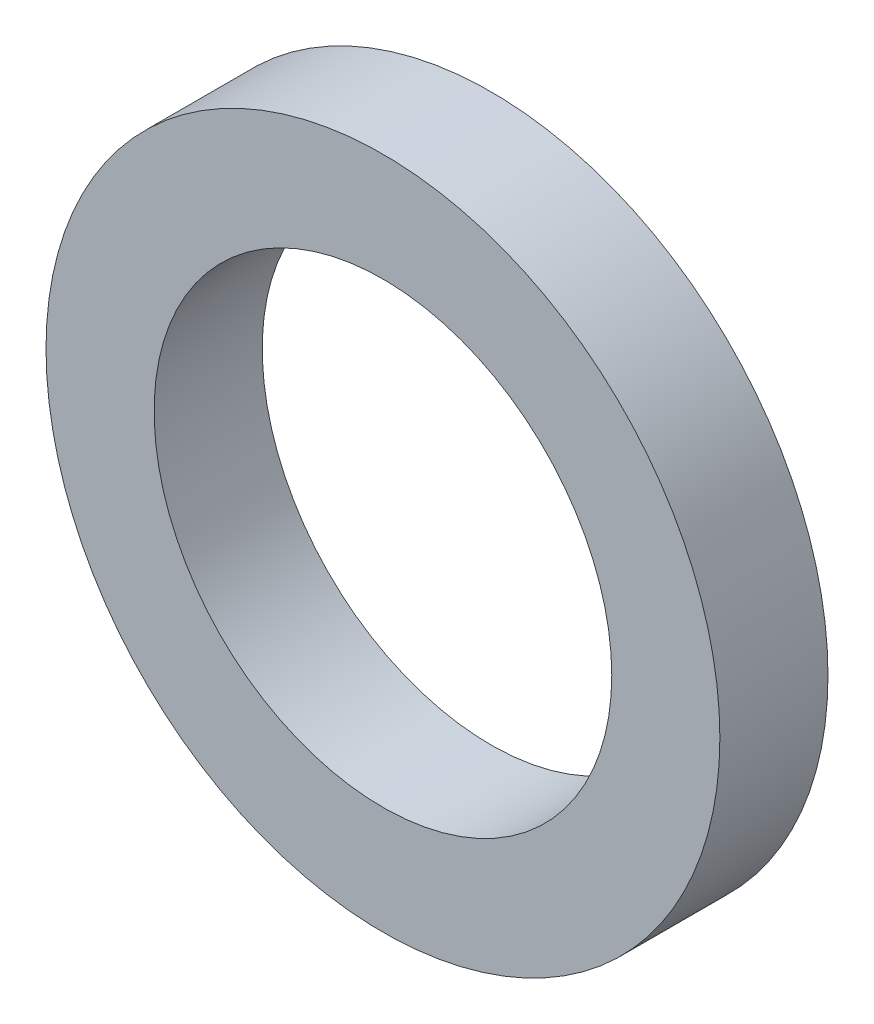
from build123d import *

# Parameters (mm, degrees)
SKETCH1_R           = 9.35
SKETCH1_R_2         = 6.35
BOSS_EXTRUDE1_DEPTH = 3


with BuildPart() as part:
    # Sketch1 → Boss-Extrude1 (new body)
    with BuildSketch(Plane.XY):
        Circle(SKETCH1_R)
        Circle(SKETCH1_R_2, mode=Mode.SUBTRACT)
    extrude(amount=BOSS_EXTRUDE1_DEPTH)


solid = part.part
